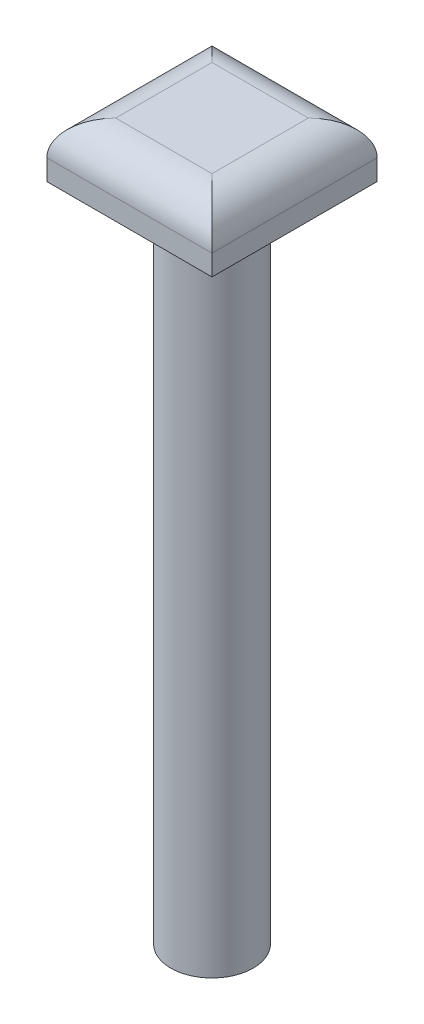
from build123d import *

# Parameters (mm, degrees)
SKETCH3_W           = 24
SKETCH3_H           = 24
BOSS_EXTRUDE1_DEPTH = 8
FILLET1_R           = 5


with BuildPart() as part:
    # Sketch1 → Revolve1 (revolve)
    with BuildSketch(Plane.XY, mode=Mode.PRIVATE) as revolve1_sk:
        Polygon((0, 56), (-12, 56), (-12, 48), (-6, 48), (-6, -48), (0, -48), align=None)
    revolve(revolve1_sk.sketch.rotate(Axis((0, -48, 0), (0, 1, 0)), 180), axis=Axis((0, -48, 0), (0, 1, 0)))

    # Sketch3 → Boss-Extrude1 (add)
    with BuildSketch(Plane.XZ.offset(-48)):
        Rectangle(SKETCH3_W, SKETCH3_H)
    extrude(amount=-BOSS_EXTRUDE1_DEPTH)

    # Fillet1
    fillet1_edges = [part.edges().sort_by_distance(p)[0] for p in [
        (-12, 56, 0),
        (0, 56, 12),
        (12, 56, 0),
        (0, 56, -12),
    ]]
    fillet(fillet1_edges, radius=FILLET1_R)


solid = part.part
